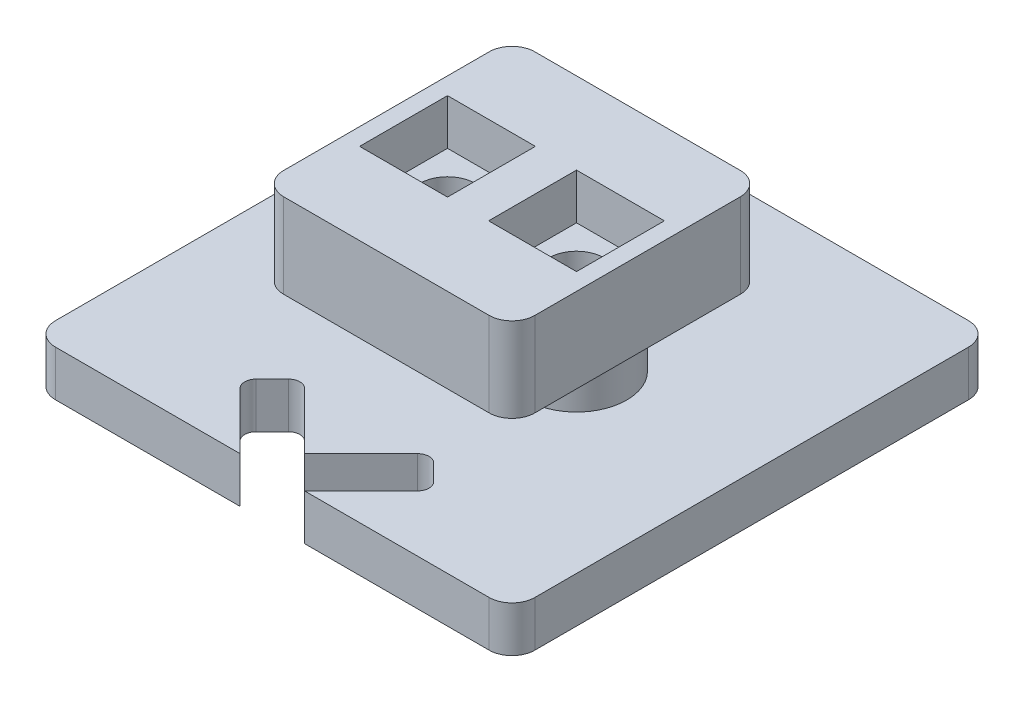
from build123d import *

# Parameters (mm, degrees)
SKETCH1_W           = 11
SKETCH1_H           = 11
BOSS_EXTRUDE1_DEPTH = 3.7
FILLET1_R           = 1
SKETCH2_W           = 3.85
SKETCH2_H           = 3.85
CUT_EXTRUDE1_DEPTH  = 2
SKETCH4_R           = 2.2
BOSS_EXTRUDE2_DEPTH = 4
BOSS_EXTRUDE3_DEPTH = 2
SKETCH3_R           = 1.2
CUT_EXTRUDE2_DEPTH  = 17.726924403
CUT_EXTRUDE3_DEPTH  = 16.90565937
SKETCH8_R           = 2.2
SKETCH8_R_2         = 1.2
BOSS_EXTRUDE4_DEPTH = 4


with BuildPart() as part:
    # Sketch1 → Boss-Extrude1 (new body)
    with BuildSketch(Plane(origin=(0, 0, 0), x_dir=(1, 0, 0), z_dir=(0, 1, 0))):
        Rectangle(SKETCH1_W, SKETCH1_H)
    extrude(amount=BOSS_EXTRUDE1_DEPTH)

    # Fillet1
    fillet1_edges = [part.edges().sort_by_distance(p)[0] for p in [
        (5.5, 1.85, 5.5),
        (-5.5, 1.85, 5.5),
        (-5.5, 1.85, -5.5),
        (5.5, 1.85, -5.5),
    ]]
    fillet(fillet1_edges, radius=FILLET1_R)

    # Sketch2 → Cut-Extrude1 (cut)
    with BuildSketch(Plane(origin=(0, 3.7, 0), x_dir=(1, 0, 0), z_dir=(0, 1, 0))):
        with Locations((-2.825, 0)):
            Rectangle(SKETCH2_W, SKETCH2_H)
        with Locations((2.825, 0)):
            Rectangle(SKETCH2_W, SKETCH2_H)
    extrude(amount=-CUT_EXTRUDE1_DEPTH, mode=Mode.SUBTRACT)

    # Sketch4 → Boss-Extrude2 (add)
    with BuildSketch(Plane(origin=(0, 0, 0), x_dir=(-1, 0, 0), z_dir=(0, -1, 0))):
        with Locations(Location((2.825, 0, 0), (0, 0, 90))):
            Circle(SKETCH4_R)
        with Locations(Location((-2.825, 0, 0), (0, 0, 90))):
            Circle(SKETCH4_R)
    extrude(amount=BOSS_EXTRUDE2_DEPTH)

    # Sketch5 → Boss-Extrude3 (add)
    with BuildSketch(Plane(origin=(0, -4, 0), x_dir=(-1, 0, 0), z_dir=(0, -1, 0))):
        with BuildLine():
            Line((9.5, 10.5), (-9.5, 10.5))
            ThreePointArc((-9.5, 10.5), (-10.207106781, 10.207106781), (-10.5, 9.5))
            Line((-10.5, 9.5), (-10.5, -9.5))
            ThreePointArc((-10.5, -9.5), (-10.207106781, -10.207106781), (-9.5, -10.5))
            Line((-9.5, -10.5), (9.5, -10.5))
            ThreePointArc((9.5, -10.5), (10.207106781, -10.207106781), (10.5, -9.5))
            Line((10.5, -9.5), (10.5, 9.5))
            ThreePointArc((10.5, 9.5), (10.207106781, 10.207106781), (9.5, 10.5))
        make_face()
    extrude(amount=-BOSS_EXTRUDE3_DEPTH)

    # Sketch3 → Cut-Extrude2 (cut, through all)
    with BuildSketch(Plane(origin=(0, 3.7, 0), x_dir=(1, 0, 0), z_dir=(0, 1, 0))):
        with Locations(Location((-2.825, 0, 0), (0, 0, 270))):
            Circle(SKETCH3_R)
        with Locations(Location((2.825, 0, 0), (0, 0, 270))):
            Circle(SKETCH3_R)
    extrude(amount=-CUT_EXTRUDE2_DEPTH, mode=Mode.SUBTRACT)

    # Sketch7 → Cut-Extrude3 (cut, through all)
    with BuildSketch(Plane(origin=(0, -2, 0), x_dir=(1, 0, 0), z_dir=(0, 1, 0))):
        with BuildLine():
            Line((0, -9.085786438), (1.414213562, -10.5))
            Line((1.414213562, -10.5), (3.889087297, -8.025126266))
            ThreePointArc((3.889087297, -8.025126266), (4.035533906, -7.671572875), (3.889087297, -7.318019485))
            Line((3.889087297, -7.318019485), (3.181980515, -6.610912703))
            ThreePointArc((3.181980515, -6.610912703), (2.828427125, -6.464466094), (2.474873734, -6.610912703))
            Line((2.474873734, -6.610912703), (0, -9.085786438))
        make_face()
        with BuildLine():
            Line((-3.889087297, -8.025126266), (-1.414213562, -10.5))
            Line((-1.414213562, -10.5), (0, -9.085786438))
            Line((0, -9.085786438), (-2.474873734, -6.610912703))
            ThreePointArc((-2.474873734, -6.610912703), (-2.828427125, -6.464466094), (-3.181980515, -6.610912703))
            Line((-3.181980515, -6.610912703), (-3.889087297, -7.318019485))
            ThreePointArc((-3.889087297, -7.318019485), (-4.035533906, -7.671572875), (-3.889087297, -8.025126266))
        make_face()
        Polygon((-1.414213562, -10.5), (1.414213562, -10.5), (0, -9.085786438), align=None)
    extrude(amount=-CUT_EXTRUDE3_DEPTH, mode=Mode.SUBTRACT)

    # Sketch8 → Boss-Extrude4 (add)
    # profile 1 of 2: a face of its own
    with BuildSketch(Plane.XZ.offset(4)):
        with Locations(Location((-2.825, 0, 0), (0, 0, 90))):
            Circle(SKETCH8_R)
        with Locations(Location((-2.825, 0, 0), (0, 0, 90))):
            Circle(SKETCH8_R_2, mode=Mode.SUBTRACT)
    # profile 2 of 2: a face of its own
    with BuildSketch(Plane.XZ.offset(4)):
        with Locations(Location((2.825, 0, 0), (0, 0, 90))):
            Circle(SKETCH8_R)
        with Locations(Location((2.825, 0, 0), (0, 0, 90))):
            Circle(SKETCH8_R_2, mode=Mode.SUBTRACT)
    extrude(amount=BOSS_EXTRUDE4_DEPTH)


solid = part.part
